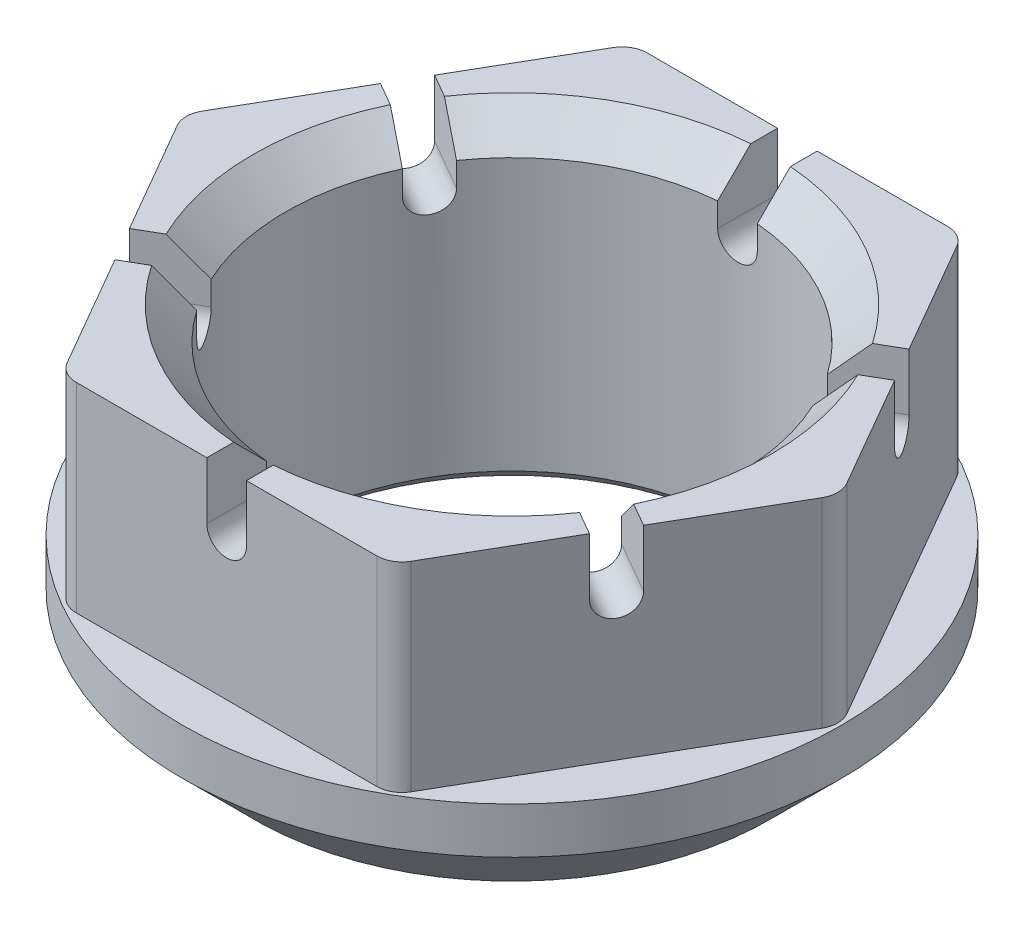
from build123d import *

# Parameters (mm, degrees)
CUT_EXTRUDE5_START = -20
CUT_EXTRUDE5_DEPTH = 20
FILLET4_R          = 2.5
CUT_EXTRUDE6_START = -86.02405492
CUT_EXTRUDE6_DEPTH = 143.469271841
CIRPATTERN2_COUNT  = 6
CHAMFER1_SIZE      = 3.302
CHAMFER2_SIZE      = 1.27


with BuildPart() as part:
    # Sketch1 → Revolve1 (revolve)
    with BuildSketch(Plane(origin=(0, 0, 0), x_dir=(0, 0, -1), z_dir=(1, 0, 0)), mode=Mode.PRIVATE) as revolve1_sk:
        Polygon((-22.6695, -31.75), (-22.6695, 0), (-33, 0), (-33, -24.619433914), (-25.8445, -31.75), align=None)
    revolve(revolve1_sk.sketch.rotate(Axis((0, 0, 0), (0, 1, 0)), 180), axis=Axis((0, 0, 0), (0, 1, 0)))

    # Sketch4 → Cut-Extrude5 (cut)
    with BuildSketch(Plane(origin=(0, 0, 0), x_dir=(1, 0, 0), z_dir=(0, 1, 0)).offset(CUT_EXTRUDE5_START)):
        with BuildLine():
            ThreePointArc((33, 0), (28.578838325, 16.5), (16.5, 28.578838325))
            Line((16.5, 28.578838325), (33, 0))
        make_face()
        with BuildLine():
            Line((-16.5, 28.578838325), (16.5, 28.578838325))
            ThreePointArc((16.5, 28.578838325), (0, 33), (-16.5, 28.578838325))
        make_face()
        with BuildLine():
            Line((-33, 0), (-16.5, 28.578838325))
            ThreePointArc((-16.5, 28.578838325), (-28.578838325, 16.5), (-33, 0))
        make_face()
        with BuildLine():
            ThreePointArc((16.5, -28.578838325), (28.578838325, -16.5), (33, 0))
            Line((33, 0), (16.5, -28.578838325))
        make_face()
        with BuildLine():
            Line((-16.5, -28.578838325), (-33, 0))
            ThreePointArc((-33, 0), (-28.578838325, -16.5), (-16.5, -28.578838325))
        make_face()
        with BuildLine():
            ThreePointArc((-16.5, -28.578838325), (0, -33), (16.5, -28.578838325))
            Line((16.5, -28.578838325), (-16.5, -28.578838325))
        make_face()
    extrude(amount=CUT_EXTRUDE5_DEPTH, mode=Mode.SUBTRACT)

    # Fillet4
    fillet4_edges = [part.edges().sort_by_distance(p)[0] for p in [
        (33, -10, 0),
        (16.5, -10, -28.578838325),
        (-33, -10, 0),
        (16.5, -10, 28.578838325),
        (-16.5, -10, -28.578838325),
        (-16.5, -10, 28.578838325),
    ]]
    fillet(fillet4_edges, radius=FILLET4_R)

    # Sketch7 → Cut-Extrude6 (cut)
    with BuildSketch(Plane.XY.offset(CUT_EXTRUDE6_START)):
        with BuildLine():
            Line((-1.984375, 0), (-1.984375, -5.715))
            ThreePointArc((-1.984375, -5.715), (0, -7.699375), (1.984375, -5.715))
            Line((1.984375, -5.715), (1.984375, 0))
            Line((1.984375, 0), (0, 0))
            Line((0, 0), (-1.984375, 0))
        make_face()
    cut_extrude6 = extrude(amount=CUT_EXTRUDE6_DEPTH, mode=Mode.SUBTRACT)

    # CirPattern2: Cut-Extrude6 ×6 about axis
    cirpattern2_axis = Axis((0, 0, 0), (0, 1, 0))
    for i in range(1, CIRPATTERN2_COUNT):
        add(cut_extrude6.rotate(cirpattern2_axis, i * 360 / CIRPATTERN2_COUNT), mode=Mode.SUBTRACT)

    # Chamfer1
    chamfer1_edges = [part.edges().sort_by_distance(p)[0] for p in [
        (-11.33475, 0, 19.632362891),
        (-22.6695, 0, 0),
        (-11.33475, 0, -19.632362891),
        (22.6695, 0, 0),
        (11.33475, 0, 19.632362891),
        (11.33475, 0, -19.632362891),
    ]]
    chamfer(chamfer1_edges, length=CHAMFER1_SIZE)

    # Chamfer2
    chamfer2_edges = [part.edges().sort_by_distance(p)[0] for p in [
        (0, -31.75, 22.6695),
    ]]
    chamfer(chamfer2_edges, length=CHAMFER2_SIZE)


solid = part.part
